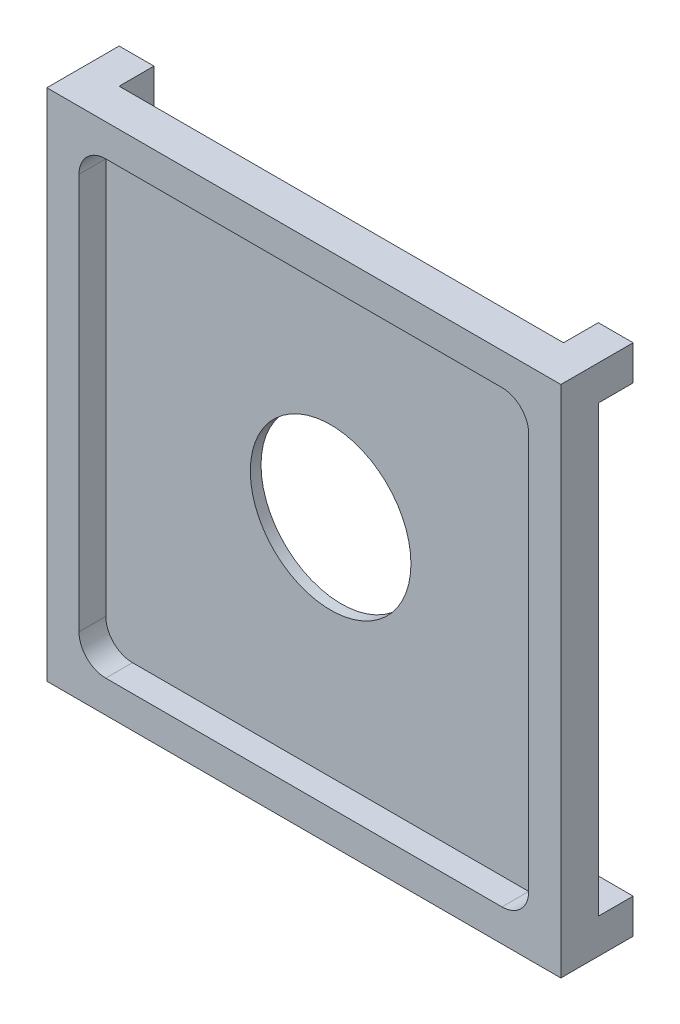
from build123d import *

# Parameters (mm, degrees)
SKETCH1_W           = 96
SKETCH1_H           = 96
BOSS_EXTRUDE1_DEPTH = 2
SKETCH2_W           = 96
SKETCH2_H           = 96
BOSS_EXTRUDE2_DEPTH = 5
SKETCH3_W           = 6.5
SKETCH3_H           = 6.5
BOSS_EXTRUDE3_DEPTH = 6.5
SKETCH5_R           = 15
CUT_EXTRUDE1_DEPTH  = 10


with BuildPart() as part:
    # Sketch1 → Boss-Extrude1 (new body)
    with BuildSketch(Plane.XY):
        Rectangle(SKETCH1_W, SKETCH1_H)
    extrude(amount=BOSS_EXTRUDE1_DEPTH)

    # Sketch2 → Boss-Extrude2 (add)
    with BuildSketch(Plane.XY.offset(2)):
        Rectangle(SKETCH2_W, SKETCH2_H)
        with BuildLine():
            Line((37, -42), (-37, -42))
            ThreePointArc((-37, -42), (-40.535533906, -40.535533906), (-42, -37))
            Line((-42, -37), (-42, 37))
            ThreePointArc((-42, 37), (-40.535533906, 40.535533906), (-37, 42))
            Line((-37, 42), (37, 42))
            ThreePointArc((37, 42), (40.535533906, 40.535533906), (42, 37))
            Line((42, 37), (42, -37))
            ThreePointArc((42, -37), (40.535533906, -40.535533906), (37, -42))
        make_face(mode=Mode.SUBTRACT)
    extrude(amount=BOSS_EXTRUDE2_DEPTH)

    # Sketch3 → Boss-Extrude3 (add)
    with BuildSketch(Plane(origin=(0, 0, 0), x_dir=(-1, 0, 0), z_dir=(0, 0, -1))):
        with Locations((-44.75, 44.75)):
            Rectangle(SKETCH3_W, SKETCH3_H)
        with Locations((44.75, 44.75)):
            Rectangle(SKETCH3_W, SKETCH3_H)
        with Locations((-44.75, -44.75)):
            Rectangle(SKETCH3_W, SKETCH3_H)
        with Locations((44.75, -44.75)):
            Rectangle(SKETCH3_W, SKETCH3_H)
    extrude(amount=BOSS_EXTRUDE3_DEPTH)

    # Sketch5 → Cut-Extrude1 (cut)
    with BuildSketch(Plane(origin=(0, 0, 0), x_dir=(-1, 0, 0), z_dir=(0, 0, -1))):
        Circle(SKETCH5_R)
    extrude(amount=-CUT_EXTRUDE1_DEPTH, mode=Mode.SUBTRACT)


solid = part.part
